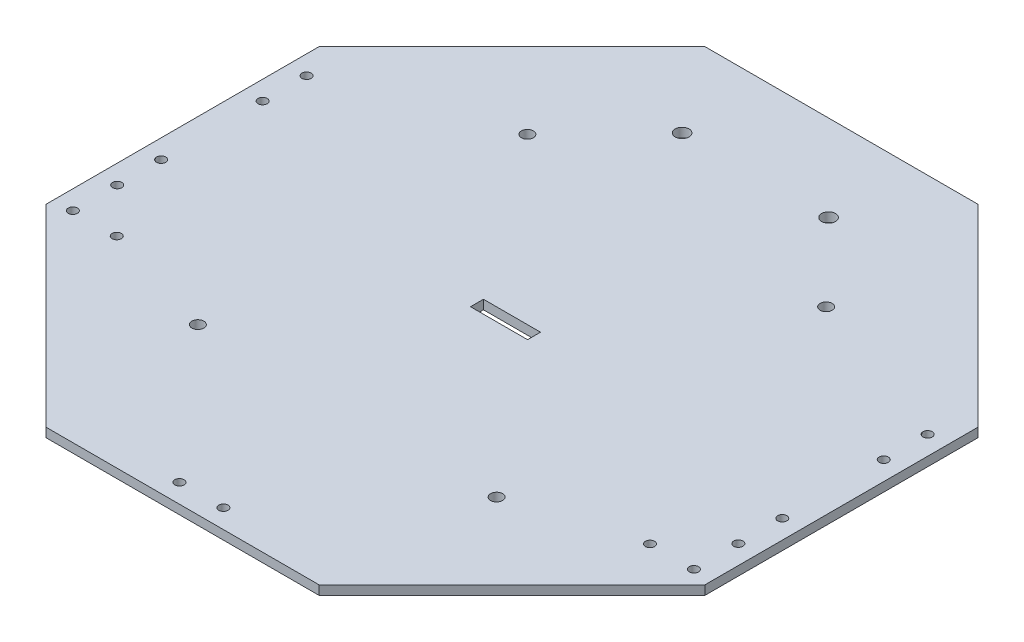
from build123d import *

# Parameters (mm, degrees)
SKETCH1_R            = 2.0828
BOSS_EXTRUDE1_DEPTH  = 3.175
M3_CLEARANCE_HOLE1_D = 3.2
SKETCH5_W            = 19.8
SKETCH5_H            = 4.5
CUT_EXTRUDE1_DEPTH   = 265.974627323
SKETCH7_R            = 2.413
CUT_EXTRUDE2_DEPTH   = 265.974627323


with BuildPart() as part:
    # Sketch1 → Boss-Extrude1 (new body)
    with BuildSketch(Plane(origin=(0, 0, 0), x_dir=(1, 0, 0), z_dir=(0, 1, 0))):
        Polygon((28.855389821, 184.15), (123.544610179, 184.15), (176.5, 131.194610179), (182.5, 125.194610179), (190.5, 117.194610179), (190.5, 22.505389821), (182.5, 14.505389821), (176.5, 8.505389821), (137.544610179, -30.45), (131.544610179, -36.45), (123.544610179, -44.45), (28.855389821, -44.45), (20.855389821, -36.45), (14.855389821, -30.45), (-24.1, 8.505389821), (-30.1, 14.505389821), (-38.1, 22.505389821), (-38.1, 117.194610179), (-30.1, 125.194610179), (-24.1, 131.194610179), align=None)
        with Locations(Location((24.384, 12.7, 0), (0, 0, 270))):
            Circle(SKETCH1_R, mode=Mode.SUBTRACT)
        with Locations(Location((128.016, 12.7, 0), (0, 0, 90))):
            Circle(SKETCH1_R, mode=Mode.SUBTRACT)
        with Locations(Location((128.016, 127, 0), (0, 0, 270))):
            Circle(SKETCH1_R, mode=Mode.SUBTRACT)
        with Locations(Location((24.384, 127, 0), (0, 0, 90))):
            Circle(SKETCH1_R, mode=Mode.SUBTRACT)
    extrude(amount=BOSS_EXTRUDE1_DEPTH)

    # M3 Clearance Hole1 (through all)
    with Locations(Plane(origin=(0, 3.175, 0), x_dir=(1, 0, 0), z_dir=(0, 1, 0))):
        with Locations((-31.5214, 106.313101446), (-31.5214, 91.073101446), (-31.5214, 55.8795536), (-31.5214, 40.6395536), (-31.5214, 25.230335162), (-16.2814, 25.230335162), (68.58, -37.8714), (83.82, -37.8714), (183.9214, 25.230335162), (168.6814, 25.230335162), (183.9214, 40.6395536), (183.9214, 55.8795536), (183.9214, 91.073101446), (183.9214, 106.313101446)):
            Hole(M3_CLEARANCE_HOLE1_D / 2)

    # Sketch5 → Cut-Extrude1 (cut, through all)
    with BuildSketch(Plane(origin=(0, 3.175, 0), x_dir=(1, 0, 0), z_dir=(0, 1, 0))):
        with Locations((76.2, 67.6)):
            Rectangle(SKETCH5_W, SKETCH5_H)
    extrude(amount=-CUT_EXTRUDE1_DEPTH, mode=Mode.SUBTRACT)

    # Sketch7 → Cut-Extrude2 (cut, through all)
    with BuildSketch(Plane(origin=(0, 3.175, 0), x_dir=(1, 0, 0), z_dir=(0, 1, 0))):
        with Locations(Location((50.8, 154.263560488, 0), (0, 0, 270))):
            Circle(SKETCH7_R)
        with Locations(Location((101.6, 154.263560488, 0), (0, 0, 90))):
            Circle(SKETCH7_R)
    extrude(amount=-CUT_EXTRUDE2_DEPTH, mode=Mode.SUBTRACT)


solid = part.part
